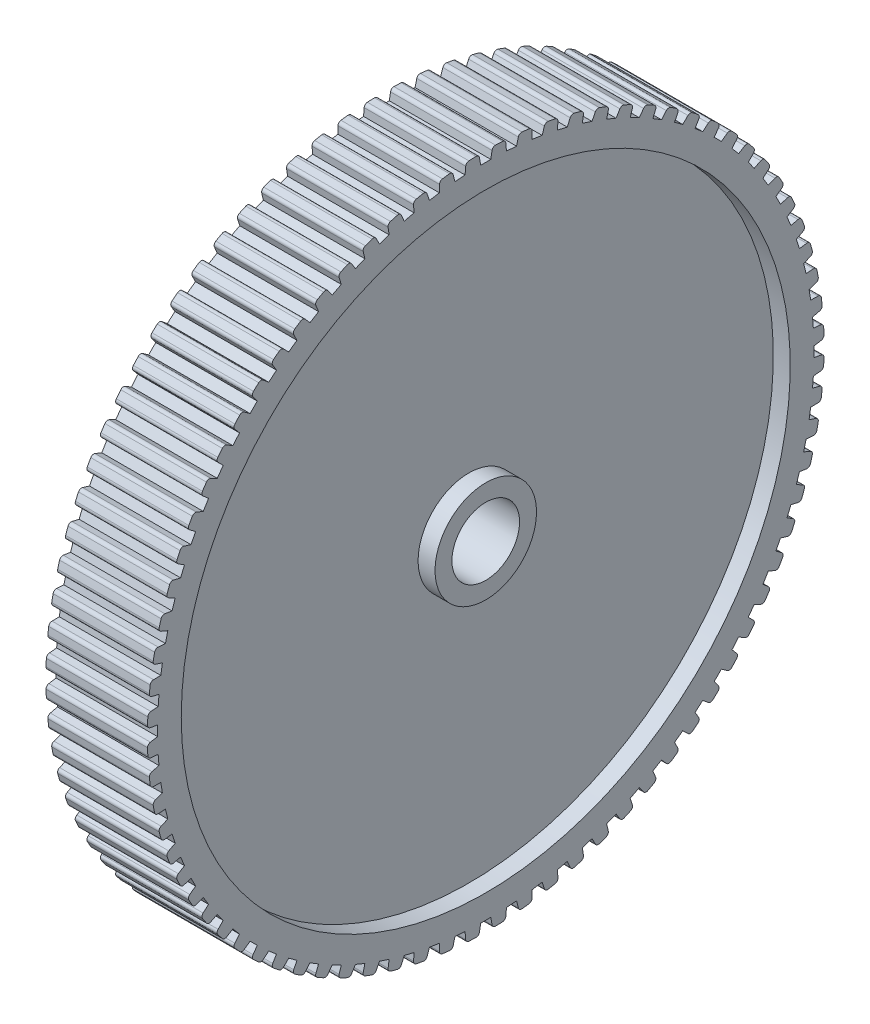
from build123d import *

# Parameters (mm, degrees)
CUT_EXTRUDE1_DEPTH       = 36
FILLET1_R                = 1
CIRPATTERN1_COUNT        = 80
FILLET1_OF_CIRPATTERN1_R = 1


with BuildPart() as part:
    # Sketch1 → Revolve1 (revolve)
    with BuildSketch(Plane.XY, mode=Mode.PRIVATE) as revolve1_sk:
        Polygon((66.500904422, 215.712435106), (96.500904422, 215.712435106), (96.500904422, 220.712435106), (91.500904422, 220.712435106), (91.500904422, 295.712435106), (96.500904422, 295.712435106), (96.500904422, 305.712435106), (66.500904422, 305.712435106), (66.500904422, 295.712435106), (71.500904422, 295.712435106), (71.500904422, 220.712435106), (66.500904422, 220.712435106), align=None)
    revolve(revolve1_sk.sketch.rotate(Axis((-291.12034718, 205.712435106, 0), (1, 0, 0)), 90), axis=Axis((-291.12034718, 205.712435106, 0), (1, 0, 0)))

    # Sketch4 → Cut-Extrude1 (cut)
    with BuildSketch(Plane(origin=(96.500904422, 0, 0), x_dir=(0, 0, -1), z_dir=(1, 0, 0))):
        Polygon((2.5, 308.712435106), (-2.5, 308.712435106), (-1.5, 302.712435106), (1.5, 302.712435106), align=None)
    cut_extrude1 = extrude(amount=-CUT_EXTRUDE1_DEPTH, mode=Mode.SUBTRACT)

    # Fillet1
    fillet1_edges = [part.edges().sort_by_distance(p)[0] for p in [
        (81.500904422, 305.692499515, -1.996677402),
        (81.500904422, 305.692499515, 1.996677402),
    ]]
    fillet(fillet1_edges, radius=FILLET1_R)

    # CirPattern1: Cut-Extrude1 ×80 about axis
    cirpattern1_axis = Axis((0, 205.712435106, 0), (1, 0, 0))
    for i in range(1, CIRPATTERN1_COUNT):
        add(cut_extrude1.rotate(cirpattern1_axis, i * 360 / CIRPATTERN1_COUNT), mode=Mode.SUBTRACT)

    # Fillet1 of CirPattern1
    fillet1_of_cirpattern1_edges = [part.edges().sort_by_distance(p)[0] for p in [
        (81.500904422, 305.540951847, 5.853823133),
        (81.500904422, 305.22763684, 9.834867756),
        (81.500904422, 304.773928176, 13.668232901),
        (81.500904422, 304.149229854, 17.61242288),
        (81.500904422, 303.39615746, 21.398373468),
        (81.500904422, 302.463927294, 25.281391561),
        (81.500904422, 301.416134111, 28.996585948),
        (81.500904422, 300.182119613, 32.794492055),
        (81.500904422, 298.846065634, 36.416024832),
        (81.500904422, 297.317874912, 40.105403601),
        (81.500904422, 295.701797355, 43.610946814),
        (81.500904422, 293.888852212, 47.169051997),
        (81.500904422, 292.002714733, 50.536992806),
        (81.500904422, 289.916192579, 53.941887502),
        (81.500904422, 287.771623842, 57.151461433),
        (81.500904422, 285.424388781, 60.382153333),
        (81.500904422, 283.034610765, 63.413572295),
        (81.500904422, 280.441134282, 66.45014311),
        (81.500904422, 277.820880764, 69.284717397),
        (81.500904422, 274.997152503, 72.108445658),
        (81.500904422, 272.162578216, 74.728699177),
        (81.500904422, 269.126007401, 77.32217566),
        (81.500904422, 266.094588439, 79.711953676),
        (81.500904422, 262.863896539, 82.059188736),
        (81.500904422, 259.654322608, 84.203757474),
        (81.500904422, 256.249427912, 86.290279627),
        (81.500904422, 252.881487103, 88.176417106),
        (81.500904422, 249.323381919, 89.989362249),
        (81.500904422, 245.817838706, 91.605439806),
        (81.500904422, 242.128459938, 93.133630529),
        (81.500904422, 238.506927161, 94.469684507),
        (81.500904422, 234.709021053, 95.703699006),
        (81.500904422, 230.993826666, 96.751492189),
        (81.500904422, 227.110808574, 97.683722354),
        (81.500904422, 223.324857986, 98.436794748),
        (81.500904422, 219.380668007, 99.061493071),
        (81.500904422, 215.547302862, 99.515201734),
        (81.500904422, 211.566258239, 99.828516741),
        (81.500904422, 207.709112507, 99.98006441),
        (81.500904422, 203.715757704, 99.98006441),
        (81.500904422, 199.858611973, 99.828516741),
        (81.500904422, 195.87756735, 99.515201734),
        (81.500904422, 192.044202205, 99.061493071),
        (81.500904422, 188.100012226, 98.436794748),
        (81.500904422, 184.314061637, 97.683722354),
        (81.500904422, 180.431043545, 96.751492189),
        (81.500904422, 176.715849158, 95.703699006),
        (81.500904422, 172.917943051, 94.469684507),
        (81.500904422, 169.296410274, 93.133630529),
        (81.500904422, 165.607031505, 91.605439806),
        (81.500904422, 162.101488292, 89.989362249),
        (81.500904422, 158.543383109, 88.176417106),
        (81.500904422, 155.175442299, 86.290279627),
        (81.500904422, 151.770547604, 84.203757474),
        (81.500904422, 148.560973673, 82.059188736),
        (81.500904422, 145.330281772, 79.711953676),
        (81.500904422, 142.29886281, 77.32217566),
        (81.500904422, 139.262291995, 74.728699177),
        (81.500904422, 136.427717709, 72.108445658),
        (81.500904422, 133.603989448, 69.284717397),
        (81.500904422, 130.983735929, 66.45014311),
        (81.500904422, 128.390259446, 63.413572295),
        (81.500904422, 126.00048143, 60.382153333),
        (81.500904422, 123.653246369, 57.151461433),
        (81.500904422, 121.508677632, 53.941887502),
        (81.500904422, 119.422155479, 50.536992806),
        (81.500904422, 117.536017999, 47.169051997),
        (81.500904422, 115.723072857, 43.610946814),
        (81.500904422, 114.1069953, 40.105403601),
        (81.500904422, 112.578804577, 36.416024832),
        (81.500904422, 111.242750599, 32.794492055),
        (81.500904422, 110.0087361, 28.996585948),
        (81.500904422, 108.960942917, 25.281391561),
        (81.500904422, 108.028712752, 21.398373468),
        (81.500904422, 107.275640357, 17.61242288),
        (81.500904422, 106.650942035, 13.668232901),
        (81.500904422, 106.197233371, 9.834867756),
        (81.500904422, 105.883918365, 5.853823133),
        (81.500904422, 105.732370696, 1.996677402),
        (81.500904422, 105.732370696, -1.996677402),
        (81.500904422, 105.883918365, -5.853823133),
        (81.500904422, 106.197233371, -9.834867756),
        (81.500904422, 106.650942035, -13.668232901),
        (81.500904422, 107.275640357, -17.61242288),
        (81.500904422, 108.028712752, -21.398373468),
        (81.500904422, 108.960942917, -25.281391561),
        (81.500904422, 110.0087361, -28.996585948),
        (81.500904422, 111.242750599, -32.794492055),
        (81.500904422, 112.578804577, -36.416024832),
        (81.500904422, 114.1069953, -40.105403601),
        (81.500904422, 115.723072857, -43.610946814),
        (81.500904422, 117.536017999, -47.169051997),
        (81.500904422, 119.422155479, -50.536992806),
        (81.500904422, 121.508677632, -53.941887502),
        (81.500904422, 123.653246369, -57.151461433),
        (81.500904422, 126.00048143, -60.382153333),
        (81.500904422, 128.390259446, -63.413572295),
        (81.500904422, 130.983735929, -66.45014311),
        (81.500904422, 133.603989448, -69.284717397),
        (81.500904422, 136.427717709, -72.108445658),
        (81.500904422, 139.262291995, -74.728699177),
        (81.500904422, 142.29886281, -77.32217566),
        (81.500904422, 145.330281772, -79.711953676),
        (81.500904422, 148.560973673, -82.059188736),
        (81.500904422, 151.770547604, -84.203757474),
        (81.500904422, 155.175442299, -86.290279627),
        (81.500904422, 158.543383109, -88.176417106),
        (81.500904422, 162.101488292, -89.989362249),
        (81.500904422, 165.607031505, -91.605439806),
        (81.500904422, 169.296410274, -93.133630529),
        (81.500904422, 172.917943051, -94.469684507),
        (81.500904422, 176.715849158, -95.703699006),
        (81.500904422, 180.431043545, -96.751492189),
        (81.500904422, 184.314061637, -97.683722354),
        (81.500904422, 188.100012226, -98.436794748),
        (81.500904422, 192.044202205, -99.061493071),
        (81.500904422, 195.87756735, -99.515201734),
        (81.500904422, 199.858611973, -99.828516741),
        (81.500904422, 203.715757704, -99.98006441),
        (81.500904422, 207.709112507, -99.98006441),
        (81.500904422, 211.566258239, -99.828516741),
        (81.500904422, 215.547302862, -99.515201734),
        (81.500904422, 219.380668007, -99.061493071),
        (81.500904422, 223.324857986, -98.436794748),
        (81.500904422, 227.110808574, -97.683722354),
        (81.500904422, 230.993826666, -96.751492189),
        (81.500904422, 234.709021053, -95.703699006),
        (81.500904422, 238.506927161, -94.469684507),
        (81.500904422, 242.128459938, -93.133630529),
        (81.500904422, 245.817838706, -91.605439806),
        (81.500904422, 249.323381919, -89.989362249),
        (81.500904422, 252.881487103, -88.176417106),
        (81.500904422, 256.249427912, -86.290279627),
        (81.500904422, 259.654322608, -84.203757474),
        (81.500904422, 262.863896539, -82.059188736),
        (81.500904422, 266.094588439, -79.711953676),
        (81.500904422, 269.126007401, -77.32217566),
        (81.500904422, 272.162578216, -74.728699177),
        (81.500904422, 274.997152503, -72.108445658),
        (81.500904422, 277.820880764, -69.284717397),
        (81.500904422, 280.441134282, -66.45014311),
        (81.500904422, 283.034610765, -63.413572295),
        (81.500904422, 285.424388781, -60.382153333),
        (81.500904422, 287.771623842, -57.151461433),
        (81.500904422, 289.916192579, -53.941887502),
        (81.500904422, 292.002714733, -50.536992806),
        (81.500904422, 293.888852212, -47.169051997),
        (81.500904422, 295.701797355, -43.610946814),
        (81.500904422, 297.317874912, -40.105403601),
        (81.500904422, 298.846065634, -36.416024832),
        (81.500904422, 300.182119613, -32.794492055),
        (81.500904422, 301.416134111, -28.996585948),
        (81.500904422, 302.463927294, -25.281391561),
        (81.500904422, 303.39615746, -21.398373468),
        (81.500904422, 304.149229854, -17.61242288),
        (81.500904422, 304.773928176, -13.668232901),
        (81.500904422, 305.22763684, -9.834867756),
        (81.500904422, 305.540951847, -5.853823133),
    ]]
    fillet(fillet1_of_cirpattern1_edges, radius=FILLET1_OF_CIRPATTERN1_R)


solid = part.part
